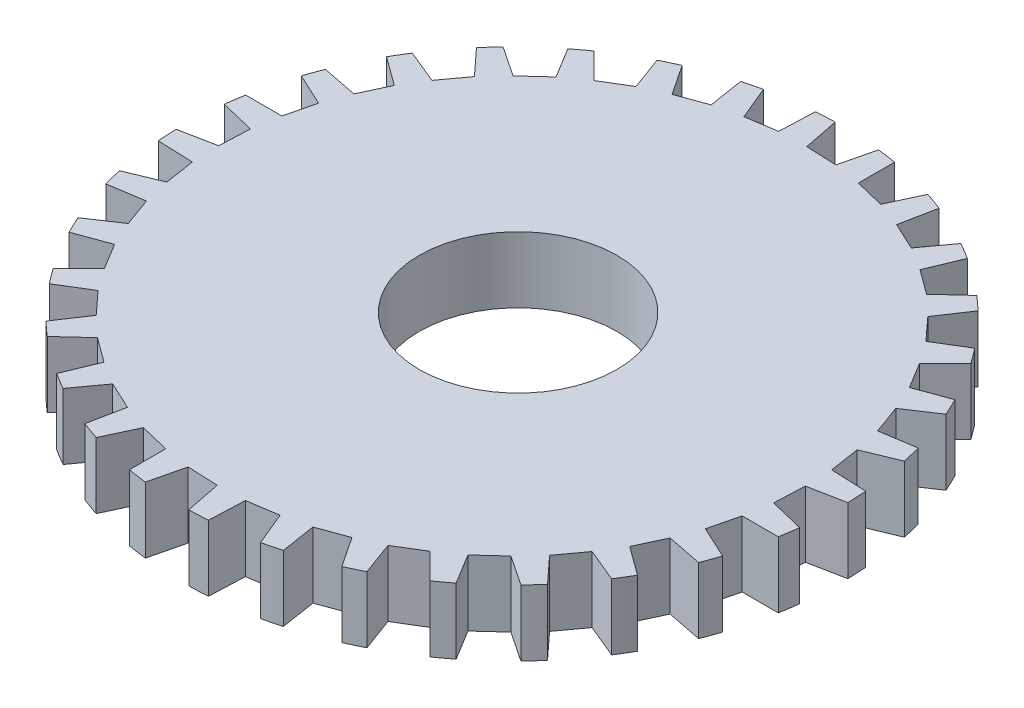
from build123d import *

# Parameters (mm, degrees)
CROQUIS1_R              = 50
SALIENTE_EXTRUIR1_DEPTH = 10
CROQUIS2_R              = 15
CORTAR_EXTRUIR1_DEPTH   = 10
CORTAR_EXTRUIR14_START  = -14
CORTAR_EXTRUIR14_DEPTH  = 14
MATRIZC1_COUNT          = 32


with BuildPart() as part:
    # Croquis1 → Saliente-Extruir1 (new body)
    with BuildSketch(Plane(origin=(0, 0, 0), x_dir=(1, 0, 0), z_dir=(0, 1, 0))):
        with Locations(Location((0, 0, 0), (0, 0, 270))):
            Circle(CROQUIS1_R)
    extrude(amount=SALIENTE_EXTRUIR1_DEPTH)

    # Croquis2 → Cortar-Extruir1 (cut)
    with BuildSketch(Plane(origin=(0, 10, 0), x_dir=(1, 0, 0), z_dir=(0, 1, 0))):
        with Locations(Location((0, 0.926579846, 0), (0, 0, 270))):
            Circle(CROQUIS2_R)
    extrude(amount=-CORTAR_EXTRUIR1_DEPTH, mode=Mode.SUBTRACT)

    # Croquis3 → Cortar-Extruir14 (cut)
    with BuildSketch(Plane(origin=(0, 10, 0), x_dir=(1, 0, 0), z_dir=(0, 1, 0)).offset(CORTAR_EXTRUIR14_START)):
        with BuildLine():
            Line((4.72393128, 44.406561165), (0.113748969, 44.606905854))
            Line((0.113748969, 44.606905854), (-0.954422894, 49.990889939))
            ThreePointArc((-0.954422894, 49.990889939), (2.523841382, 49.936261621), (5.989888947, 49.639915697))
            Line((5.989888947, 49.639915697), (4.72393128, 44.406561165))
        make_face()
    cortar_extruir14 = extrude(amount=CORTAR_EXTRUIR14_DEPTH, mode=Mode.SUBTRACT)

    # MatrizC1: Cortar-Extruir14 ×32 about axis
    matrizc1_axis = Axis((0, 0, 0), (0, 1, 0))
    for i in range(1, MATRIZC1_COUNT):
        add(cortar_extruir14.rotate(matrizc1_axis, i * 360 / MATRIZC1_COUNT), mode=Mode.SUBTRACT)


solid = part.part
